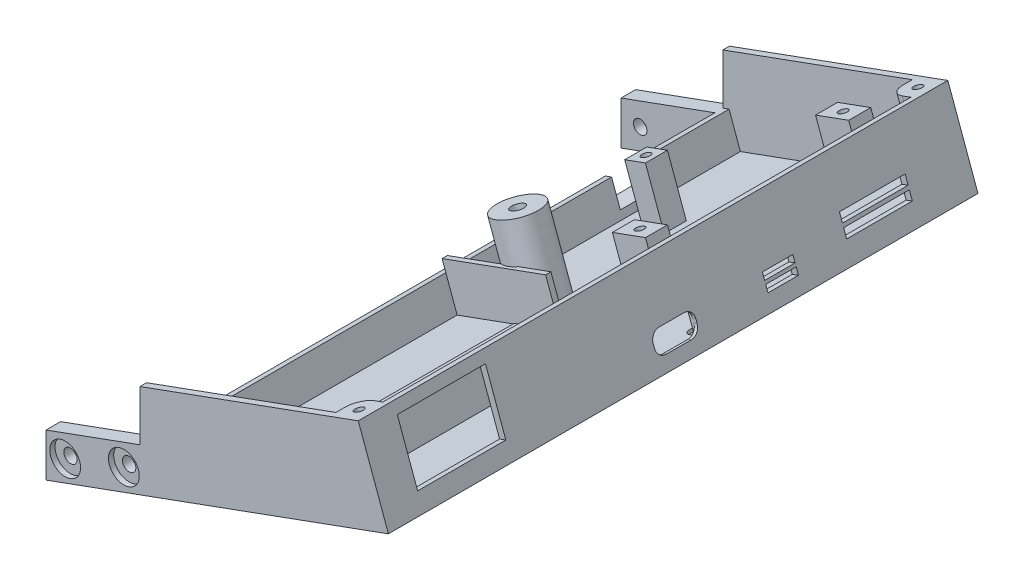
from build123d import *

# Parameters (mm, degrees)
SKETCH1_R            = 1.525
BOSS_EXTRUDE1_DEPTH  = 3.5
CUT_EXTRUDE1_DEPTH   = 0.2
BOSS_EXTRUDE2_DEPTH  = 133.760231922
CUT_EXTRUDE2_DEPTH   = 7.5
BOSS_EXTRUDE3_DEPTH  = 1.5
BOSS_EXTRUDE4_DEPTH  = 1.5
SKETCH7_W            = 130.760231922
SKETCH7_H            = 10.753073792
BOSS_EXTRUDE5_DEPTH  = 1.5
SKETCH8_W            = 11
SKETCH8_H            = 4.957202362
SKETCH8_H_2          = 3.215619275
CUT_EXTRUDE3_DEPTH   = 5
SKETCH9_R            = 1.65
CUT_EXTRUDE4_DEPTH   = 1.8
SKETCH10_W           = 1.3
SKETCH10_H           = 9.7
CUT_EXTRUDE5_DEPTH   = 6
CUT_EXTRUDE6_DEPTH   = 6
SKETCH12_W           = 14.9
SKETCH12_H           = 2
SKETCH12_W_2         = 6.9
SKETCH12_H_2         = 1.5
CUT_EXTRUDE7_DEPTH   = 6
SKETCH13_W           = 8
SKETCH13_H           = 5
SKETCH13_W_2         = 5
BOSS_EXTRUDE6_DEPTH  = 12.5
SKETCH14_R           = 1
CUT_EXTRUDE8_DEPTH   = 10
SKETCH15_W           = 1.2
SKETCH15_H           = 50
SKETCH15_W_2         = 25
SKETCH15_H_2         = 1.2
BOSS_EXTRUDE7_DEPTH  = 10
SKETCH16_W           = 20
SKETCH16_H           = 13.5
CUT_EXTRUDE9_DEPTH   = 10
BOSS_EXTRUDE8_DEPTH  = 18.253073792
SKETCH18_R           = 1
CUT_EXTRUDE10_DEPTH  = 147.462286341
SKETCH20_R           = 3.5
CUT_EXTRUDE11_DEPTH  = 1.2
CUT_EXTRUDE12_START  = -1.2
SKETCH21_R           = 3.5
CUT_EXTRUDE12_DEPTH  = 1.2
SKETCH22_R           = 3.5
CUT_EXTRUDE13_DEPTH  = 0.8
SKETCH23_R           = 2.75
CUT_EXTRUDE14_DEPTH  = 0.8
BOSS_EXTRUDE9_START  = -0.3
SKETCH24_R           = 1.65
SKETCH24_R_2         = 1
BOSS_EXTRUDE9_DEPTH  = 0.3
CUT_EXTRUDE15_DEPTH  = 3.3
BOSS_EXTRUDE10_REACH = 148.096
SKETCH26_R           = 5
SKETCH26_R_2         = 1.5


with BuildPart() as part:
    # Sketch1 → Boss-Extrude1 (new body)
    # profile 1 of 2: a face of its own
    with BuildSketch(Plane.XY):
        Polygon((15.051303021, -38.27542782), (15, -38.294100593), (15, -48.134473927), (15.140953893, -48.083170906), (15.140953893, -38.242797571), align=None)
    # profile 2 of 2: a face of its own
    with BuildSketch(Plane.XY):
        Polygon((15, -38.294100593), (-6.161400994, -45.99622067), (-6.161401424, -55.836594161), (15, -48.134473927), align=None)
        with Locations((-1.811401221, -49.49692768)):
            Circle(SKETCH1_R, mode=Mode.SUBTRACT)
        with Locations((11.5, -44.459086185)):
            Circle(SKETCH1_R, mode=Mode.SUBTRACT)
    extrude(amount=BOSS_EXTRUDE1_DEPTH)

    # Sketch2 → Cut-Extrude1 (cut)
    with BuildSketch(Plane(origin=(0, 0, 0), x_dir=(-1, 0, 0), z_dir=(0, 0, -1))):
        Polygon((6.161400994, -45.99622067), (-15.140953893, -38.242797571), (-15.140953893, -48.083170906), (6.161401424, -55.836594161), align=None)
    extrude(amount=-CUT_EXTRUDE1_DEPTH, mode=Mode.SUBTRACT)


with BuildPart() as body_2:
    # Mirror2: mirrored copy
    add(part.part.mirror(Plane.XY.offset(-63.380115961)))


with BuildPart() as part_1:
    add(part.part)

    add(body_2.part)  # Boss-Extrude2 merges body 2
    # Sketch3 → Boss-Extrude2 (add)
    with BuildSketch(Plane.XY.offset(3.5)):
        Polygon((15.140953893, -48.083170906), (15.140953893, -38.242797571), (68.359876113, -18.872693984), (71.52251114, -27.561962306), align=None)
    extrude(amount=-BOSS_EXTRUDE2_DEPTH)

    # Sketch4 → Cut-Extrude2 (cut)
    with BuildSketch(Plane(origin=(14.062153369, -38.635448851, 0), x_dir=(0.9396926207859062, 0.34202014332567476, 0), z_dir=(-0.34202014332567476, 0.9396926207859062, 0))):
        Polygon((56.28242964, -2), (56.28242964, 128.760231922), (2.648035538, 128.760231922), (2.648035538, 126.960231922), (2.648035538, -0.2), (2.648035538, -2), align=None)
    extrude(amount=-CUT_EXTRUDE2_DEPTH, mode=Mode.SUBTRACT)

    # Sketch5 → Boss-Extrude3 (add)
    with BuildSketch(Plane.XY.offset(3.5)):
        Polygon((64.682108274, -8.76810989), (15.15, -26.796322942), (15.15, -38.134473927), (15.15, -38.239505058), (68.359876113, -18.872693984), align=None)
    extrude(amount=-BOSS_EXTRUDE3_DEPTH)

    # Sketch6 → Boss-Extrude4 (add)
    with BuildSketch(Plane(origin=(0, 0, -130.260231922), x_dir=(-1, 0, 0), z_dir=(0, 0, -1))):
        Polygon((-15.15, -38.239505058), (-15.15, -26.796322942), (-64.682108274, -8.76810989), (-68.359876113, -18.872693984), align=None)
    extrude(amount=-BOSS_EXTRUDE4_DEPTH)

    # Sketch7 → Boss-Extrude5 (add)
    with BuildSketch(Plane(origin=(54.297722744, 19.762754867, 0), x_dir=(0, 0, -1), z_dir=(0.9396926207859062, 0.34202014332567454, 0))):
        with Locations((63.380115961, -35.738449001)):
            Rectangle(SKETCH7_W, SKETCH7_H)
    extrude(amount=-BOSS_EXTRUDE5_DEPTH)

    # Sketch8 → Cut-Extrude3 (cut)
    with BuildSketch(Plane.ZY.offset(-15.140953893)):
        with Locations((-107.6, -40.721398752)):
            Rectangle(SKETCH8_W, SKETCH8_H)
        with Locations((-107.6, -36.634987933)):
            Rectangle(SKETCH8_W, SKETCH8_H_2)
    extrude(amount=-CUT_EXTRUDE3_DEPTH, mode=Mode.SUBTRACT)

    # Sketch9 → Cut-Extrude4 (cut)
    with BuildSketch(Plane(origin=(16.627304444, -45.683143507, 0), x_dir=(0.939692620785918, 0.3420201433256426, 0), z_dir=(-0.3420201433256426, 0.939692620785918, 0))):
        with Locations(Location((53.18242964, 55.380115961, 0), (0, 0, 180))):
            Circle(SKETCH9_R)
        with Locations(Location((53.18242964, 71.380115961, 0), (0, 0, 180))):
            Circle(SKETCH9_R)
    extrude(amount=-CUT_EXTRUDE4_DEPTH, mode=Mode.SUBTRACT)

    # Sketch10 → Cut-Extrude5 (cut)
    with BuildSketch(Plane(origin=(16.627304444, -45.683143507, 0), x_dir=(0.939692620785918, 0.3420201433256426, 0), z_dir=(-0.3420201433256426, 0.939692620785918, 0))):
        with Locations((56.33242964, 63.380115961)):
            Rectangle(SKETCH10_W, SKETCH10_H)
    extrude(amount=CUT_EXTRUDE5_DEPTH, mode=Mode.SUBTRACT)

    # Sketch11 → Cut-Extrude6 (cut)
    with BuildSketch(Plane(origin=(54.297722744, 19.762754867, 0), x_dir=(0, 0, -1), z_dir=(0.9396926207859063, 0.3420201433256746, 0))):
        with BuildLine():
            Line((66.230115961, -43.414985897), (60.530115961, -43.414985897))
            add(Edge.make_bspline(
                [(60.530115961, -43.414985897), (56.530115961, -43.414985897), (56.530115961, -47.414985897), (60.530115961, -47.414985897)],
                knots=[0, 0, 0, 0, 1, 1, 1, 1], degree=3, weights=[1, 0.333333333, 0.333333333, 1]))
            Line((60.530115961, -47.414985897), (66.230115961, -47.414985897))
            add(Edge.make_bspline(
                [(66.230115961, -47.414985897), (70.230115961, -47.414985897), (70.230115961, -43.414985897), (66.230115961, -43.414985897)],
                knots=[0, 0, 0, 0, 1, 1, 1, 1], degree=3, weights=[1, 0.333333333, 0.333333333, 1]))
        make_face()
    extrude(amount=-CUT_EXTRUDE6_DEPTH, mode=Mode.SUBTRACT)

    # Sketch12 → Cut-Extrude7 (cut)
    with BuildSketch(Plane(origin=(54.297722744, 19.762754867, 0), x_dir=(0, 0, -1), z_dir=(0.9396926207859063, 0.3420201433256746, 0))):
        with Locations((109.510231922, -41.914985897)):
            Rectangle(SKETCH12_W, SKETCH12_H)
        with Locations((109.510231922, -44.714985897)):
            Rectangle(SKETCH12_W, SKETCH12_H)
        with Locations((87.210231922, -44.064985897)):
            Rectangle(SKETCH12_W_2, SKETCH12_H_2)
        with Locations((87.210231922, -46.264985897)):
            Rectangle(SKETCH12_W_2, SKETCH12_H_2)
    extrude(amount=-CUT_EXTRUDE7_DEPTH, mode=Mode.SUBTRACT)

    # Sketch13 → Boss-Extrude6 (add)
    with BuildSketch(Plane(origin=(16.627304444, -45.683143507, 0), x_dir=(0.939692620785918, 0.3420201433256426, 0), z_dir=(-0.3420201433256426, 0.939692620785918, 0))):
        with Locations((35.73242964, 79.160231922)):
            Rectangle(SKETCH13_W, SKETCH13_H)
        with Locations((35.73242964, 125.260231922)):
            Rectangle(SKETCH13_W, SKETCH13_H)
        with Locations((12.68242964, 102.210231922)):
            Rectangle(SKETCH13_W_2, SKETCH13_H)
    extrude(amount=BOSS_EXTRUDE6_DEPTH)

    # Sketch14 → Cut-Extrude8 (cut)
    with BuildSketch(Plane(origin=(12.352052653, -33.936985747, 0), x_dir=(0.939692620785918, 0.3420201433256426, 0), z_dir=(-0.3420201433256426, 0.939692620785918, 0))):
        with Locations(Location((35.73242964, 79.160231922, 0), (0, 0, 180))):
            Circle(SKETCH14_R)
        with Locations(Location((12.68242964, 102.210231922, 0), (0, 0, 180))):
            Circle(SKETCH14_R)
        with Locations(Location((35.73242964, 125.260231922, 0), (0, 0, 180))):
            Circle(SKETCH14_R)
    extrude(amount=-CUT_EXTRUDE8_DEPTH, mode=Mode.SUBTRACT)

    # Sketch15 → Boss-Extrude7 (add)
    with BuildSketch(Plane(origin=(16.627304444, -45.683143507, 0), x_dir=(0.939692620785918, 0.3420201433256426, 0), z_dir=(-0.3420201433256426, 0.939692620785918, 0))):
        with Locations((38.248035538, 23)):
            Rectangle(SKETCH15_W, SKETCH15_H)
        with Locations((15.148035538, 65.1)):
            Rectangle(SKETCH15_W_2, SKETCH15_H_2)
    extrude(amount=BOSS_EXTRUDE7_DEPTH)

    # Sketch16 → Cut-Extrude9 (cut)
    with BuildSketch(Plane(origin=(54.297722744, 19.762754867, 0), x_dir=(0, 0, -1), z_dir=(0.9396926207859062, 0.34202014332567454, 0))):
        with Locations((14.5, -39.611912105)):
            Rectangle(SKETCH16_W, SKETCH16_H)
    extrude(amount=-CUT_EXTRUDE9_DEPTH, mode=Mode.SUBTRACT)

    # Sketch17 → Boss-Extrude8 (add)
    with BuildSketch(Plane(origin=(16.627304444, -45.683143507, 0), x_dir=(0.939692620785918, 0.3420201433256426, 0), z_dir=(-0.3420201433256426, 0.939692620785918, 0))):
        with BuildLine():
            Line((56.28242964, 123.260231922), (57.78242964, 123.260231922))
            Line((57.78242964, 123.260231922), (57.78242964, 126.760231922))
            ThreePointArc((57.78242964, 126.760231922), (57.384848052, 125.140046748), (56.28242964, 123.887950599))
            Line((56.28242964, 123.887950599), (56.28242964, 123.260231922))
        make_face()
        with BuildLine():
            ThreePointArc((56.28242964, 123.887950599), (57.384848052, 125.140046748), (57.78242964, 126.760231922))
            ThreePointArc((57.78242964, 126.760231922), (56.757303374, 129.235105657), (54.28242964, 130.260231922))
            ThreePointArc((54.28242964, 130.260231922), (52.662244466, 129.862650334), (51.410148317, 128.760231922))
            Line((51.410148317, 128.760231922), (56.28242964, 128.760231922))
            Line((56.28242964, 128.760231922), (56.28242964, 123.887950599))
        make_face()
        with BuildLine():
            ThreePointArc((50.78242964, 126.760231922), (51.807555906, 124.285358188), (54.28242964, 123.260231922))
            ThreePointArc((54.28242964, 123.260231922), (55.330526813, 123.420846902), (56.28242964, 123.887950599))
            Line((56.28242964, 123.887950599), (56.28242964, 128.760231922))
            Line((56.28242964, 128.760231922), (51.410148317, 128.760231922))
            ThreePointArc((51.410148317, 128.760231922), (50.94304462, 127.808329095), (50.78242964, 126.760231922))
        make_face()
        with BuildLine():
            Line((54.28242964, 123.260231922), (56.28242964, 123.260231922))
            Line((56.28242964, 123.260231922), (56.28242964, 123.887950599))
            ThreePointArc((56.28242964, 123.887950599), (55.330526813, 123.420846902), (54.28242964, 123.260231922))
        make_face()
        with BuildLine():
            ThreePointArc((54.28242964, 130.260231922), (56.757303374, 129.235105657), (57.78242964, 126.760231922))
            Line((57.78242964, 126.760231922), (57.78242964, 130.260231922))
            Line((57.78242964, 130.260231922), (54.28242964, 130.260231922))
        make_face()
        with BuildLine():
            ThreePointArc((51.410148317, 128.760231922), (52.662244466, 129.862650334), (54.28242964, 130.260231922))
            Line((54.28242964, 130.260231922), (50.78242964, 130.260231922))
            Line((50.78242964, 130.260231922), (50.78242964, 128.760231922))
            Line((50.78242964, 128.760231922), (51.410148317, 128.760231922))
        make_face()
        with BuildLine():
            Line((50.78242964, 128.760231922), (50.78242964, 126.760231922))
            ThreePointArc((50.78242964, 126.760231922), (50.94304462, 127.808329095), (51.410148317, 128.760231922))
            Line((51.410148317, 128.760231922), (50.78242964, 128.760231922))
        make_face()
        with BuildLine():
            Line((57.78242964, 3.5), (56.28242964, 3.5))
            Line((56.28242964, 3.5), (56.28242964, 2.872281323))
            ThreePointArc((56.28242964, 2.872281323), (57.384848052, 1.620185175), (57.78242964, 0))
            Line((57.78242964, 0), (57.78242964, 3.5))
        make_face()
        with BuildLine():
            Line((56.28242964, 3.5), (54.28242964, 3.5))
            ThreePointArc((54.28242964, 3.5), (55.330526813, 3.339385021), (56.28242964, 2.872281323))
            Line((56.28242964, 2.872281323), (56.28242964, 3.5))
        make_face()
        with BuildLine():
            ThreePointArc((54.28242964, 3.5), (51.807555906, 2.474873734), (50.78242964, 0))
            ThreePointArc((50.78242964, 0), (50.94304462, -1.048097173), (51.410148317, -2))
            Line((51.410148317, -2), (56.28242964, -2))
            Line((56.28242964, -2), (56.28242964, 2.872281323))
            ThreePointArc((56.28242964, 2.872281323), (55.330526813, 3.339385021), (54.28242964, 3.5))
        make_face()
        with BuildLine():
            Line((56.28242964, -2), (51.410148317, -2))
            ThreePointArc((51.410148317, -2), (52.662244468, -3.102418413), (54.282429645, -3.5))
            ThreePointArc((54.282429645, -3.5), (56.757303376, -2.474873732), (57.78242964, 0))
            ThreePointArc((57.78242964, 0), (57.384848052, 1.620185175), (56.28242964, 2.872281323))
            Line((56.28242964, 2.872281323), (56.28242964, -2))
        make_face()
        with BuildLine():
            ThreePointArc((57.78242964, 0), (56.757303376, -2.474873732), (54.282429645, -3.5))
            Line((54.282429645, -3.5), (57.78242964, -3.5))
            Line((57.78242964, -3.5), (57.78242964, 0))
        make_face()
        with BuildLine():
            Line((51.410148317, -2), (50.78242964, -2))
            Line((50.78242964, -2), (50.78242964, -3.5))
            Line((50.78242964, -3.5), (54.282429645, -3.5))
            ThreePointArc((54.282429645, -3.5), (52.662244468, -3.102418413), (51.410148317, -2))
        make_face()
        with BuildLine():
            ThreePointArc((51.410148317, -2), (50.94304462, -1.048097173), (50.78242964, 0))
            Line((50.78242964, 0), (50.78242964, -2))
            Line((50.78242964, -2), (51.410148317, -2))
        make_face()
    extrude(amount=BOSS_EXTRUDE8_DEPTH)

    # Sketch18 → Cut-Extrude10 (cut, through all)
    with BuildSketch(Plane(origin=(10.38438553, -28.530864758, 0), x_dir=(0.9396926207859062, 0.3420201433256749, 0), z_dir=(-0.3420201433256749, 0.9396926207859062, 0))):
        with Locations(Location((54.28242964, 0, 0), (0, 0, 180))):
            Circle(SKETCH18_R)
        with Locations(Location((54.28242964, 126.760231922, 0), (0, 0, 180))):
            Circle(SKETCH18_R)
    extrude(amount=-CUT_EXTRUDE10_DEPTH, mode=Mode.SUBTRACT)

    # Sketch20 → Cut-Extrude11 (cut)
    with BuildSketch(Plane.XY.offset(3.5)):
        with Locations((11.5, -44.459086185)):
            Circle(SKETCH20_R)
        with Locations((-1.811401221, -49.49692768)):
            Circle(SKETCH20_R)
    extrude(amount=-CUT_EXTRUDE11_DEPTH, mode=Mode.SUBTRACT)

    # Sketch21 → Cut-Extrude12 (cut)
    with BuildSketch(Plane(origin=(0, 0, -130.260231922), x_dir=(-1, 0, 0), z_dir=(0, 0, -1)).offset(CUT_EXTRUDE12_START)):
        with Locations(Location((1.811401221, -49.49692768, 0), (0, 0, 180))):
            Circle(SKETCH21_R)
        with Locations(Location((-11.5, -44.459086185, 0), (0, 0, 180))):
            Circle(SKETCH21_R)
    extrude(amount=CUT_EXTRUDE12_DEPTH, mode=Mode.SUBTRACT)

    # Sketch22 → Cut-Extrude13 (cut)
    with BuildSketch(Plane(origin=(17.224788396, -47.324717173, 0), x_dir=(0.9396926207858846, 0.3420201433257345, 0), z_dir=(0.34202014332573444, -0.9396926207858844, 0))):
        with Locations((53.18242964, -55.380115961)):
            Circle(SKETCH22_R)
        with Locations((53.18242964, -71.380115961)):
            Circle(SKETCH22_R)
    extrude(amount=-CUT_EXTRUDE13_DEPTH, mode=Mode.SUBTRACT)

    # Sketch23 → Cut-Extrude14 (cut)
    with BuildSketch(Plane(origin=(17.224788396, -47.324717173, 0), x_dir=(0.9396926207858846, 0.3420201433257345, 0), z_dir=(0.34202014332573444, -0.9396926207858844, 0))):
        with Locations((54.28242964, -126.760231922)):
            Circle(SKETCH23_R)
        with Locations((54.28242964, 0)):
            Circle(SKETCH23_R)
    extrude(amount=-CUT_EXTRUDE14_DEPTH, mode=Mode.SUBTRACT)

    # Sketch24 → Boss-Extrude9 (add)
    with BuildSketch(Plane(origin=(16.951172282, -46.572963077, 0), x_dir=(0.9396926207858844, 0.3420201433257346, 0), z_dir=(0.3420201433257346, -0.9396926207858846, 0)).offset(BOSS_EXTRUDE9_START)):
        with Locations(Location((53.18242964, -55.380115961, 0), (0, 0, 180))):
            Circle(SKETCH24_R)
        with Locations(Location((53.18242964, -71.380115961, 0), (0, 0, 180))):
            Circle(SKETCH24_R)
        with Locations(Location((54.28242964, 0, 0), (0, 0, 180))):
            Circle(SKETCH24_R_2)
        with Locations(Location((54.28242964, -126.760231922, 0), (0, 0, 180))):
            Circle(SKETCH24_R_2)
    extrude(amount=BOSS_EXTRUDE9_DEPTH)

    # Sketch25 → Cut-Extrude15 (cut)
    with BuildSketch(Plane(origin=(54.297722744, 19.762754867, 0), x_dir=(0, 0, -1), z_dir=(0.9396926207859063, 0.34202014332567476, 0))):
        with BuildLine():
            ThreePointArc((60.530115961, -42.614985897), (59.115902399, -43.200772334), (58.530115961, -44.614985897))
            ThreePointArc((58.530115961, -44.614985897), (58.540243655, -44.816003821), (58.570524167, -45.014985897))
            ThreePointArc((58.570524167, -45.014985897), (59.265204897, -43.865792558), (60.530115961, -43.414985897))
            Line((60.530115961, -43.414985897), (66.230115961, -43.414985897))
            ThreePointArc((66.230115961, -43.414985897), (67.495027025, -43.865792558), (68.189707755, -45.014985897))
            ThreePointArc((68.189707755, -45.014985897), (68.219988267, -44.816003821), (68.230115961, -44.614985897))
            ThreePointArc((68.230115961, -44.614985897), (67.644329524, -43.200772334), (66.230115961, -42.614985897))
            Line((66.230115961, -42.614985897), (60.530115961, -42.614985897))
        make_face()
        with BuildLine():
            Line((58.530115961, -44.614985897), (58.530115961, -45.414985897))
            ThreePointArc((58.530115961, -45.414985897), (58.540243655, -45.213967973), (58.570524167, -45.014985897))
            ThreePointArc((58.570524167, -45.014985897), (58.540243655, -44.816003821), (58.530115961, -44.614985897))
        make_face()
        with BuildLine():
            ThreePointArc((68.189707755, -45.014985897), (68.219988267, -45.213967973), (68.230115961, -45.414985897))
            Line((68.230115961, -45.414985897), (68.230115961, -44.614985897))
            ThreePointArc((68.230115961, -44.614985897), (68.219988267, -44.816003821), (68.189707755, -45.014985897))
        make_face()
    extrude(amount=-CUT_EXTRUDE15_DEPTH, mode=Mode.SUBTRACT)

    # Boss-Extrude10: up to this face of the body (flat: up to its plane)
    boss_extrude10_end = Plane(part_1.part.faces().sort_by_distance((16.50101023, -26.304595432, 2.75))[0])
    # Sketch26 → Boss-Extrude10 (add, up to the picked face)
    with BuildSketch(Plane(origin=(16.627304444, -45.683143507, 0), x_dir=(0.9396926207859062, 0.34202014332567476, 0), z_dir=(-0.34202014332567476, 0.9396926207859063, 0)), mode=Mode.PRIVATE) as boss_extrude10_sk1:
        with Locations((17.78242964, 70.260231922)):
            Circle(SKETCH26_R)
        with Locations((17.78242964, 70.260231922)):
            Circle(SKETCH26_R_2, mode=Mode.SUBTRACT)
    boss_extrude10_tool1 = split(extrude(boss_extrude10_sk1.sketch, amount=BOSS_EXTRUDE10_REACH, mode=Mode.PRIVATE), bisect_by=boss_extrude10_end, keep=Keep.BOTH, mode=Mode.PRIVATE)
    add(boss_extrude10_tool1.solids().sort_by(Axis((28.771752, -41.262926, -70.260232), (-0.34202014332567476, 0.9396926207859063, 0)))[0])


solid = part_1.part
